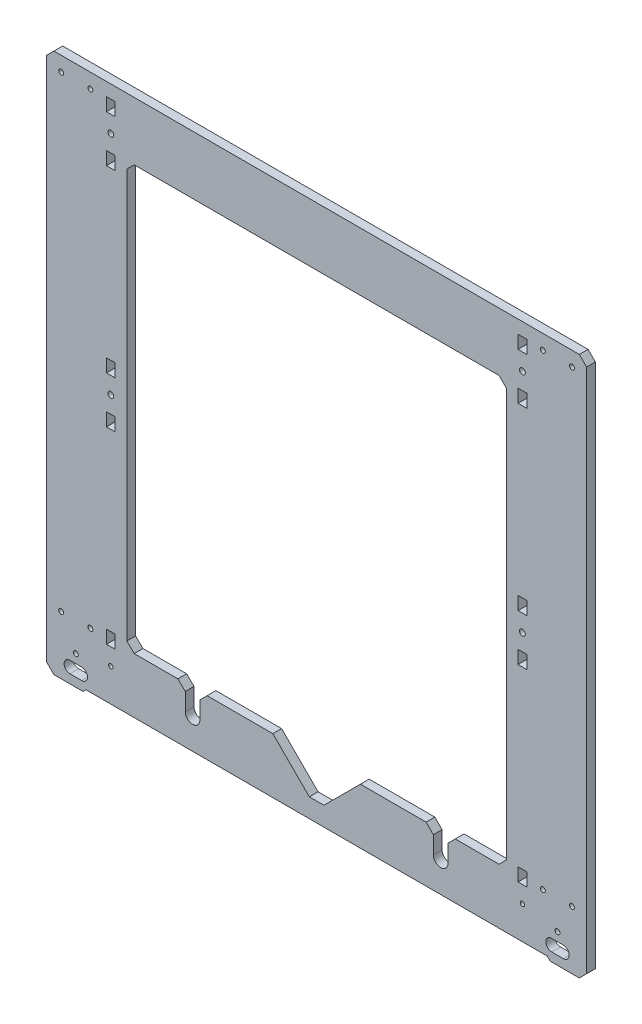
from build123d import *

# Parameters (mm, degrees)
SZKIC1_W                    = 370
SZKIC1_H                    = 370
SZKIC1_W_2                  = 260
SZKIC1_H_2                  = 290
DODANIE_WYCI_GNI_CIE1_DEPTH = 6
WYTNIJ_WYCI_GNI_CIE1_REACH  = 263.698
SFAZOWANIE1_SIZE            = 5
WYTNIJ_WYCI_GNI_CIE2_REACH  = 263.698
WYTNIJ_WYCI_GNI_CIE3_REACH  = 263.698
SZKIC4_R                    = 2
SZKIC4_R_2                  = 1.5
SZKIC4_W                    = 6
SZKIC4_H                    = 9
WYTNIJ_WYCI_GNI_CIE4_REACH  = 263.698
SZKIC5_R                    = 1.7
WYTNIJ_WYCI_GNI_CIE5_REACH  = 263.698


with BuildPart() as part:
    # Szkic1 → Dodanie-wyciągnięcie1 (new body)
    with BuildSketch(Plane.XY):
        Rectangle(SZKIC1_W, SZKIC1_H)
        Rectangle(SZKIC1_W_2, SZKIC1_H_2, mode=Mode.SUBTRACT)
    extrude(amount=DODANIE_WYCI_GNI_CIE1_DEPTH)

    # Szkic2 → Wytnij-wyciągnięcie1 (cut, up to next)
    with BuildSketch(Plane.XY.offset(6), mode=Mode.PRIVATE) as wytnij_wyci_gni_cie1_sk1:
        with BuildLine():
            Line((90, -145), (90, -162))
            ThreePointArc((90, -162), (85, -167), (80, -162))
            Line((80, -162), (80, -145))
            Line((80, -145), (90, -145))
        make_face()
    wytnij_wyci_gni_cie1_tool1 = extrude(wytnij_wyci_gni_cie1_sk1.sketch, amount=-WYTNIJ_WYCI_GNI_CIE1_REACH, mode=Mode.PRIVATE) & part.part
    # Szkic2 → Wytnij-wyciągnięcie1 (cut, up to next)
    with BuildSketch(Plane.XY.offset(6), mode=Mode.PRIVATE) as wytnij_wyci_gni_cie1_sk2:
        Polygon((-5, -170), (5, -170), (30, -145), (-30, -145), align=None)
    wytnij_wyci_gni_cie1_tool2 = extrude(wytnij_wyci_gni_cie1_sk2.sketch, amount=-WYTNIJ_WYCI_GNI_CIE1_REACH, mode=Mode.PRIVATE) & part.part
    # Szkic2 → Wytnij-wyciągnięcie1 (cut, up to next)
    with BuildSketch(Plane.XY.offset(6), mode=Mode.PRIVATE) as wytnij_wyci_gni_cie1_sk3:
        with BuildLine():
            Line((-90, -145), (-90, -162))
            ThreePointArc((-90, -162), (-85, -167), (-80, -162))
            Line((-80, -162), (-80, -145))
            Line((-80, -145), (-90, -145))
        make_face()
    wytnij_wyci_gni_cie1_tool3 = extrude(wytnij_wyci_gni_cie1_sk3.sketch, amount=-WYTNIJ_WYCI_GNI_CIE1_REACH, mode=Mode.PRIVATE) & part.part
    add(wytnij_wyci_gni_cie1_tool1.solids().sort_by_distance((85, -155.493251, 6))[0], mode=Mode.SUBTRACT)
    add(wytnij_wyci_gni_cie1_tool2.solids().sort_by_distance((0, -154.52381, 6))[0], mode=Mode.SUBTRACT)
    add(wytnij_wyci_gni_cie1_tool3.solids().sort_by_distance((-85, -155.493251, 6))[0], mode=Mode.SUBTRACT)

    # Sfazowanie1
    sfazowanie1_edges = [part.edges().sort_by_distance(p)[0] for p in [
        (-130, 145, 3),
        (-130, -145, 3),
        (130, -145, 3),
        (130, 145, 3),
        (80, -145, 3),
        (90, -145, 3),
        (-90, -145, 3),
        (-80, -145, 3),
        (185, -185, 3),
        (-185, -185, 3),
        (-185, 185, 3),
        (185, 185, 3),
    ]]
    chamfer(sfazowanie1_edges, length=SFAZOWANIE1_SIZE)

    # Szkic3 → Wytnij-wyciągnięcie2 (cut, up to next)
    with BuildSketch(Plane.XY.offset(6), mode=Mode.PRIVATE) as wytnij_wyci_gni_cie2_sk1:
        Polygon((-158, -183), (158, -183), (160, -185), (-160, -185), align=None)
    wytnij_wyci_gni_cie2_tool1 = extrude(wytnij_wyci_gni_cie2_sk1.sketch, amount=-WYTNIJ_WYCI_GNI_CIE2_REACH, mode=Mode.PRIVATE) & part.part
    add(wytnij_wyci_gni_cie2_tool1.solids().sort_by_distance((0, -184.002096, 6))[0], mode=Mode.SUBTRACT)

    # Szkic4 → Wytnij-wyciągnięcie3 (cut, up to next)
    with BuildSketch(Plane.XY.offset(6), mode=Mode.PRIVATE) as wytnij_wyci_gni_cie3_sk1:
        with Locations((141, 155.5)):
            Circle(SZKIC4_R)
    wytnij_wyci_gni_cie3_tool1 = extrude(wytnij_wyci_gni_cie3_sk1.sketch, amount=-WYTNIJ_WYCI_GNI_CIE3_REACH, mode=Mode.PRIVATE) & part.part
    # Szkic4 → Wytnij-wyciągnięcie3 (cut, up to next)
    with BuildSketch(Plane.XY.offset(6), mode=Mode.PRIVATE) as wytnij_wyci_gni_cie3_sk2:
        with Locations((141, 0.5)):
            Circle(SZKIC4_R)
    wytnij_wyci_gni_cie3_tool2 = extrude(wytnij_wyci_gni_cie3_sk2.sketch, amount=-WYTNIJ_WYCI_GNI_CIE3_REACH, mode=Mode.PRIVATE) & part.part
    # Szkic4 → Wytnij-wyciągnięcie3 (cut, up to next)
    with BuildSketch(Plane.XY.offset(6), mode=Mode.PRIVATE) as wytnij_wyci_gni_cie3_sk3:
        with Locations((141, -160.5)):
            Circle(SZKIC4_R_2)
    wytnij_wyci_gni_cie3_tool3 = extrude(wytnij_wyci_gni_cie3_sk3.sketch, amount=-WYTNIJ_WYCI_GNI_CIE3_REACH, mode=Mode.PRIVATE) & part.part
    # Szkic4 → Wytnij-wyciągnięcie3 (cut, up to next)
    with BuildSketch(Plane.XY.offset(6), mode=Mode.PRIVATE) as wytnij_wyci_gni_cie3_sk4:
        with Locations((141, 171.5)):
            Rectangle(SZKIC4_W, SZKIC4_H)
    wytnij_wyci_gni_cie3_tool4 = extrude(wytnij_wyci_gni_cie3_sk4.sketch, amount=-WYTNIJ_WYCI_GNI_CIE3_REACH, mode=Mode.PRIVATE) & part.part
    # Szkic4 → Wytnij-wyciągnięcie3 (cut, up to next)
    with BuildSketch(Plane.XY.offset(6), mode=Mode.PRIVATE) as wytnij_wyci_gni_cie3_sk5:
        with Locations((141, 139.5)):
            Rectangle(SZKIC4_W, SZKIC4_H)
    wytnij_wyci_gni_cie3_tool5 = extrude(wytnij_wyci_gni_cie3_sk5.sketch, amount=-WYTNIJ_WYCI_GNI_CIE3_REACH, mode=Mode.PRIVATE) & part.part
    # Szkic4 → Wytnij-wyciągnięcie3 (cut, up to next)
    with BuildSketch(Plane.XY.offset(6), mode=Mode.PRIVATE) as wytnij_wyci_gni_cie3_sk6:
        with Locations((141, -15.5)):
            Rectangle(SZKIC4_W, SZKIC4_H)
    wytnij_wyci_gni_cie3_tool6 = extrude(wytnij_wyci_gni_cie3_sk6.sketch, amount=-WYTNIJ_WYCI_GNI_CIE3_REACH, mode=Mode.PRIVATE) & part.part
    # Szkic4 → Wytnij-wyciągnięcie3 (cut, up to next)
    with BuildSketch(Plane.XY.offset(6), mode=Mode.PRIVATE) as wytnij_wyci_gni_cie3_sk7:
        with Locations((141, 16.5)):
            Rectangle(SZKIC4_W, SZKIC4_H)
    wytnij_wyci_gni_cie3_tool7 = extrude(wytnij_wyci_gni_cie3_sk7.sketch, amount=-WYTNIJ_WYCI_GNI_CIE3_REACH, mode=Mode.PRIVATE) & part.part
    # Szkic4 → Wytnij-wyciągnięcie3 (cut, up to next)
    with BuildSketch(Plane.XY.offset(6), mode=Mode.PRIVATE) as wytnij_wyci_gni_cie3_sk8:
        with Locations((141, -144.5)):
            Rectangle(SZKIC4_W, SZKIC4_H)
    wytnij_wyci_gni_cie3_tool8 = extrude(wytnij_wyci_gni_cie3_sk8.sketch, amount=-WYTNIJ_WYCI_GNI_CIE3_REACH, mode=Mode.PRIVATE) & part.part
    wytnij_wyci_gni_cie3_1 = wytnij_wyci_gni_cie3_tool1.solids().sort_by_distance((141, 155.5, 6))[0]
    add(wytnij_wyci_gni_cie3_1, mode=Mode.SUBTRACT)
    wytnij_wyci_gni_cie3_2 = wytnij_wyci_gni_cie3_tool2.solids().sort_by_distance((141, 0.5, 6))[0]
    add(wytnij_wyci_gni_cie3_2, mode=Mode.SUBTRACT)
    wytnij_wyci_gni_cie3_3 = wytnij_wyci_gni_cie3_tool3.solids().sort_by_distance((141, -160.5, 6))[0]
    add(wytnij_wyci_gni_cie3_3, mode=Mode.SUBTRACT)
    wytnij_wyci_gni_cie3_4 = wytnij_wyci_gni_cie3_tool4.solids().sort_by_distance((141, 171.5, 6))[0]
    add(wytnij_wyci_gni_cie3_4, mode=Mode.SUBTRACT)
    wytnij_wyci_gni_cie3_5 = wytnij_wyci_gni_cie3_tool5.solids().sort_by_distance((141, 139.5, 6))[0]
    add(wytnij_wyci_gni_cie3_5, mode=Mode.SUBTRACT)
    wytnij_wyci_gni_cie3_6 = wytnij_wyci_gni_cie3_tool6.solids().sort_by_distance((141, -15.5, 6))[0]
    add(wytnij_wyci_gni_cie3_6, mode=Mode.SUBTRACT)
    wytnij_wyci_gni_cie3_7 = wytnij_wyci_gni_cie3_tool7.solids().sort_by_distance((141, 16.5, 6))[0]
    add(wytnij_wyci_gni_cie3_7, mode=Mode.SUBTRACT)
    wytnij_wyci_gni_cie3_8 = wytnij_wyci_gni_cie3_tool8.solids().sort_by_distance((141, -144.5, 6))[0]
    add(wytnij_wyci_gni_cie3_8, mode=Mode.SUBTRACT)
    wytnij_wyci_gni_cie3 = wytnij_wyci_gni_cie3_1 + wytnij_wyci_gni_cie3_2 + wytnij_wyci_gni_cie3_3 + wytnij_wyci_gni_cie3_4 + wytnij_wyci_gni_cie3_5 + wytnij_wyci_gni_cie3_6 + wytnij_wyci_gni_cie3_7 + wytnij_wyci_gni_cie3_8  # Wytnij-wyciągnięcie3 as one shape, for the pattern or mirror that repeats it

    # Szkic5 → Wytnij-wyciągnięcie4 (cut, up to next)
    with BuildSketch(Plane.XY.offset(6), mode=Mode.PRIVATE) as wytnij_wyci_gni_cie4_sk1:
        with Locations((175, 175)):
            Circle(SZKIC5_R)
    wytnij_wyci_gni_cie4_tool1 = extrude(wytnij_wyci_gni_cie4_sk1.sketch, amount=-WYTNIJ_WYCI_GNI_CIE4_REACH, mode=Mode.PRIVATE) & part.part
    # Szkic5 → Wytnij-wyciągnięcie4 (cut, up to next)
    with BuildSketch(Plane.XY.offset(6), mode=Mode.PRIVATE) as wytnij_wyci_gni_cie4_sk2:
        with Locations((155, 175)):
            Circle(SZKIC5_R)
    wytnij_wyci_gni_cie4_tool2 = extrude(wytnij_wyci_gni_cie4_sk2.sketch, amount=-WYTNIJ_WYCI_GNI_CIE4_REACH, mode=Mode.PRIVATE) & part.part
    # Szkic5 → Wytnij-wyciągnięcie4 (cut, up to next)
    with BuildSketch(Plane.XY.offset(6), mode=Mode.PRIVATE) as wytnij_wyci_gni_cie4_sk3:
        with Locations((175, -145)):
            Circle(SZKIC5_R)
    wytnij_wyci_gni_cie4_tool3 = extrude(wytnij_wyci_gni_cie4_sk3.sketch, amount=-WYTNIJ_WYCI_GNI_CIE4_REACH, mode=Mode.PRIVATE) & part.part
    # Szkic5 → Wytnij-wyciągnięcie4 (cut, up to next)
    with BuildSketch(Plane.XY.offset(6), mode=Mode.PRIVATE) as wytnij_wyci_gni_cie4_sk4:
        with Locations((155, -145)):
            Circle(SZKIC5_R)
    wytnij_wyci_gni_cie4_tool4 = extrude(wytnij_wyci_gni_cie4_sk4.sketch, amount=-WYTNIJ_WYCI_GNI_CIE4_REACH, mode=Mode.PRIVATE) & part.part
    # Szkic5 → Wytnij-wyciągnięcie4 (cut, up to next)
    with BuildSketch(Plane.XY.offset(6), mode=Mode.PRIVATE) as wytnij_wyci_gni_cie4_sk5:
        with Locations((165, -165)):
            Circle(SZKIC5_R)
    wytnij_wyci_gni_cie4_tool5 = extrude(wytnij_wyci_gni_cie4_sk5.sketch, amount=-WYTNIJ_WYCI_GNI_CIE4_REACH, mode=Mode.PRIVATE) & part.part
    wytnij_wyci_gni_cie4_1 = wytnij_wyci_gni_cie4_tool1.solids().sort_by_distance((175, 175, 6))[0]
    add(wytnij_wyci_gni_cie4_1, mode=Mode.SUBTRACT)
    wytnij_wyci_gni_cie4_2 = wytnij_wyci_gni_cie4_tool2.solids().sort_by_distance((155, 175, 6))[0]
    add(wytnij_wyci_gni_cie4_2, mode=Mode.SUBTRACT)
    wytnij_wyci_gni_cie4_3 = wytnij_wyci_gni_cie4_tool3.solids().sort_by_distance((175, -145, 6))[0]
    add(wytnij_wyci_gni_cie4_3, mode=Mode.SUBTRACT)
    wytnij_wyci_gni_cie4_4 = wytnij_wyci_gni_cie4_tool4.solids().sort_by_distance((155, -145, 6))[0]
    add(wytnij_wyci_gni_cie4_4, mode=Mode.SUBTRACT)
    wytnij_wyci_gni_cie4_5 = wytnij_wyci_gni_cie4_tool5.solids().sort_by_distance((165, -165, 6))[0]
    add(wytnij_wyci_gni_cie4_5, mode=Mode.SUBTRACT)
    wytnij_wyci_gni_cie4 = wytnij_wyci_gni_cie4_1 + wytnij_wyci_gni_cie4_2 + wytnij_wyci_gni_cie4_3 + wytnij_wyci_gni_cie4_4 + wytnij_wyci_gni_cie4_5  # Wytnij-wyciągnięcie4 as one shape, for the pattern or mirror that repeats it

    # Szkic6 → Wytnij-wyciągnięcie5 (cut, up to next)
    with BuildSketch(Plane(origin=(0, 0, 0), x_dir=(-1, 0, 0), z_dir=(0, 0, -1)), mode=Mode.PRIVATE) as wytnij_wyci_gni_cie5_sk1:
        with BuildLine():
            Line((161, -171), (169, -171))
            ThreePointArc((169, -171), (173, -175), (169, -179))
            Line((169, -179), (161, -179))
            ThreePointArc((161, -179), (157, -175), (161, -171))
        make_face()
    wytnij_wyci_gni_cie5_tool1 = extrude(wytnij_wyci_gni_cie5_sk1.sketch, amount=-WYTNIJ_WYCI_GNI_CIE5_REACH, mode=Mode.PRIVATE) & part.part
    wytnij_wyci_gni_cie5 = wytnij_wyci_gni_cie5_tool1.solids().sort_by_distance((-165, -175, 0))[0]
    add(wytnij_wyci_gni_cie5, mode=Mode.SUBTRACT)

    # Lustro1: Wytnij-wyciągnięcie3, Wytnij-wyciągnięcie4, Wytnij-wyciągnięcie5 across plane
    add(wytnij_wyci_gni_cie3.mirror(Plane(origin=(0, 0, 0), x_dir=(0, 0, 1), z_dir=(1, 0, 0))), mode=Mode.SUBTRACT)
    add(wytnij_wyci_gni_cie4.mirror(Plane(origin=(0, 0, 0), x_dir=(0, 0, 1), z_dir=(1, 0, 0))), mode=Mode.SUBTRACT)
    add(wytnij_wyci_gni_cie5.mirror(Plane(origin=(0, 0, 0), x_dir=(0, 0, 1), z_dir=(1, 0, 0))), mode=Mode.SUBTRACT)


solid = part.part
